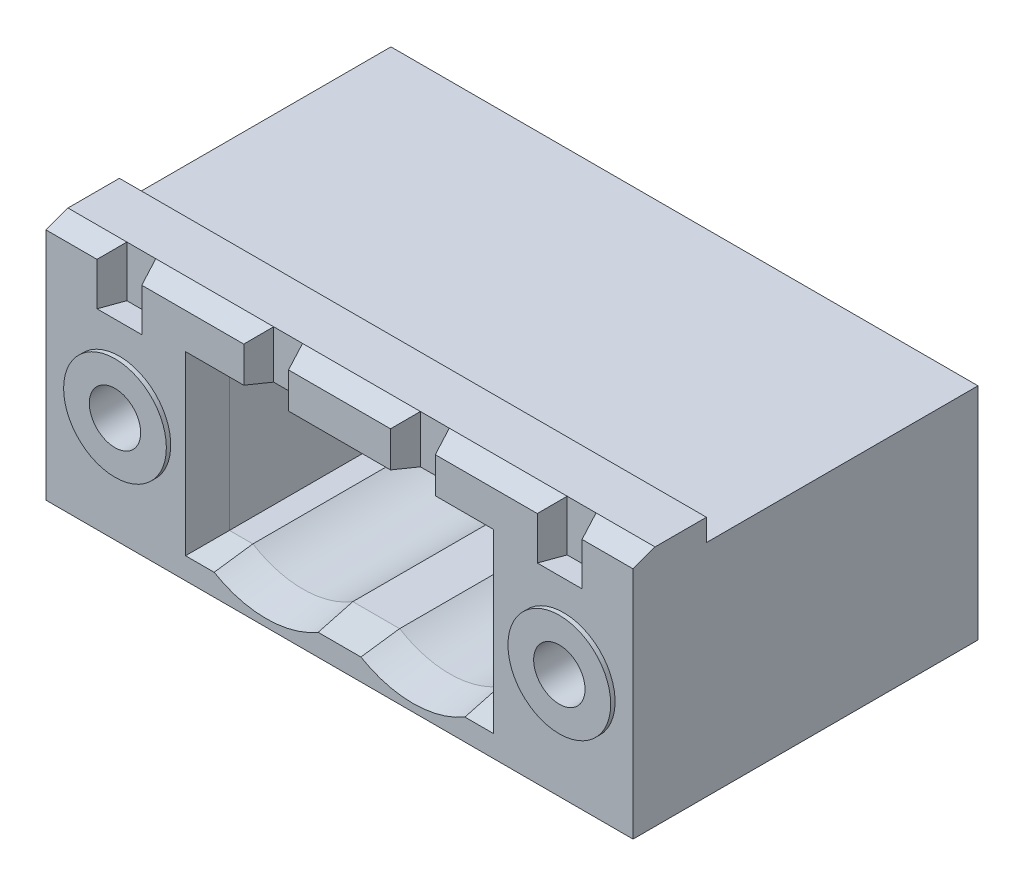
from build123d import *

# Parameters (mm, degrees)
BOSS_EXTRUDE1_DEPTH = 10.16
CUT_EXTRUDE1_DEPTH  = 10
CHAMFER1_SIZE       = 0.25
CHAMFER1_SIZE2      = 1.27
SKETCH3_R           = 1.778
BOSS_EXTRUDE2_DEPTH = 0.152
SKETCH4_R           = 0.889
CUT_EXTRUDE2_DEPTH  = 5.08
BOSS_EXTRUDE3_START = 0.9525
BOSS_EXTRUDE3_DEPTH = 0.9525
BOSS_EXTRUDE4_START = 0.318
BOSS_EXTRUDE4_DEPTH = 0.318
BOSS_EXTRUDE5_START = 0.635
SKETCH9_R           = 1.143
BOSS_EXTRUDE5_DEPTH = 0.635
CUT_EXTRUDE3_REACH  = 18.592
SKETCH11_R          = 0.64
CUT_EXTRUDE4_DEPTH  = 6.7
SKETCH12_R          = 0.64
CUT_EXTRUDE6_DEPTH  = 4
CUT_EXTRUDE7_DEPTH  = 1.27
SKETCH15_R          = 0.125
CUT_EXTRUDE8_DEPTH  = 14.860565005


with BuildPart() as part:
    # Sketch1 → Boss-Extrude1 (new, symmetric)
    with BuildSketch(Plane(origin=(0, 0, 0), x_dir=(0, 0, -1), z_dir=(1, 0, 0))):
        Polygon((-9.94, -3.81), (2, -3.81), (2, 3.81), (-7.4, 3.81), (-7.4, 4.57), (-9.18, 4.57), (-9.94, 4.293), align=None)
    extrude(amount=BOSS_EXTRUDE1_DEPTH, both=True)

    # Sketch2 → Cut-Extrude1 (cut)
    with BuildSketch(Plane.XY.offset(9.94)):
        with BuildLine():
            Line((-0.809711007, -2.81), (0.809711007, -2.81))
            ThreePointArc((0.809711007, -2.81), (2.54, -3.3), (4.270288993, -2.81))
            Line((4.270288993, -2.81), (5.08, -2.81))
            Line((5.08, -2.81), (5.08, 2.81))
            Line((5.08, 2.81), (-5.08, 2.81))
            Line((-5.08, 2.81), (-5.08, -2.81))
            Line((-5.08, -2.81), (-4.270288993, -2.81))
            ThreePointArc((-4.270288993, -2.81), (-2.54, -3.3), (-0.809711007, -2.81))
        make_face()
    extrude(amount=-CUT_EXTRUDE1_DEPTH, mode=Mode.SUBTRACT)

    # Chamfer1
    chamfer1_edges = [part.edges().sort_by_distance(p)[0] for p in [
        (-5.08, 0, 9.94),
        (-4.675144497, -2.81, 9.94),
        (-2.54, -3.3, 9.94),
        (0, -2.81, 9.94),
        (2.54, -3.3, 9.94),
        (4.675144497, -2.81, 9.94),
        (5.08, 0, 9.94),
        (0, 2.81, 9.94),
    ]]
    chamfer1_side = [part.faces().sort_by_distance(p)[0] for p in [
        (-9.941239627, 0.2415, 9.94),
    ]]
    chamfer(chamfer1_edges, length=CHAMFER1_SIZE, length2=CHAMFER1_SIZE2, reference=chamfer1_side[0])

    # Sketch3 → Boss-Extrude2 (add)
    with BuildSketch(Plane.XY.offset(9.94)):
        with Locations(Location((-7.62, 0, 0), (0, 0, 180))):
            Circle(SKETCH3_R)
        with Locations(Location((7.76, 0, 0), (0, 0, 180))):
            Circle(SKETCH3_R)
    extrude(amount=BOSS_EXTRUDE2_DEPTH)

    # Sketch4 → Cut-Extrude2 (cut)
    with BuildSketch(Plane.XY.offset(10.092)):
        with Locations((-7.62, 0)):
            Circle(SKETCH4_R)
        with Locations((7.76, 0)):
            Circle(SKETCH4_R)
    extrude(amount=-CUT_EXTRUDE2_DEPTH, mode=Mode.SUBTRACT)

    # Sketch5 → Boss-Extrude3 (add)
    with BuildSketch(Plane.XY.offset(-0.06).offset(BOSS_EXTRUDE3_START)):
        with BuildLine():
            Line((-3.175, 2.81), (-3.175, 1.662881535))
            ThreePointArc((-3.175, 1.662881535), (-3.798650071, 1.258650071), (-4.202881535, 0.635))
            Line((-4.202881535, 0.635), (-5.08, 0.635))
            Line((-5.08, 0.635), (-5.08, -0.635))
            Line((-5.08, -0.635), (-4.202881535, -0.635))
            ThreePointArc((-4.202881535, -0.635), (-3.798650071, -1.258650071), (-3.175, -1.662881535))
            Line((-3.175, -1.662881535), (-3.175, -3.238329044))
            ThreePointArc((-3.175, -3.238329044), (-2.54, -3.3), (-1.905, -3.238329044))
            Line((-1.905, -3.238329044), (-1.905, -1.662881535))
            ThreePointArc((-1.905, -1.662881535), (-1.281349929, -1.258650071), (-0.877118465, -0.635))
            Line((-0.877118465, -0.635), (0, -0.635))
            Line((0, -0.635), (0, 0.635))
            Line((0, 0.635), (-0.877118465, 0.635))
            ThreePointArc((-0.877118465, 0.635), (-1.281349929, 1.258650071), (-1.905, 1.662881535))
            Line((-1.905, 1.662881535), (-1.905, 2.81))
            Line((-1.905, 2.81), (-3.175, 2.81))
        make_face()
    boss_extrude3 = extrude(amount=-BOSS_EXTRUDE3_DEPTH)

    # Mirror1: Boss-Extrude3 across plane
    add(boss_extrude3.mirror(Plane(origin=(0, 0, 0), x_dir=(0, 0, 1), z_dir=(1, 0, 0))))

    # Sketch8 → Boss-Extrude4 (add)
    with BuildSketch(Plane.XY.offset(0.8925).offset(BOSS_EXTRUDE4_START)):
        with BuildLine():
            Line((-4.202881535, 0.635), (-3.490380976, 0.635))
            ThreePointArc((-3.490380976, 0.635), (-2.54, 1.143), (-1.589619024, 0.635))
            Line((-1.589619024, 0.635), (-0.877118465, 0.635))
            Line((-0.877118465, 0.635), (0.877118465, 0.635))
            Line((0.877118465, 0.635), (1.589619024, 0.635))
            ThreePointArc((1.589619024, 0.635), (2.54, 1.143), (3.490380976, 0.635))
            Line((3.490380976, 0.635), (4.202881535, 0.635))
            Line((4.202881535, 0.635), (5.08, 0.635))
            Line((5.08, 0.635), (5.08, -0.635))
            Line((5.08, -0.635), (4.202881535, -0.635))
            ThreePointArc((4.202881535, -0.635), (3.798650071, -1.258650071), (3.175, -1.662881535))
            Line((3.175, -1.662881535), (3.175, -3.238329044))
            ThreePointArc((3.175, -3.238329044), (2.54, -3.3), (1.905, -3.238329044))
            Line((1.905, -3.238329044), (1.905, -1.662881535))
            ThreePointArc((1.905, -1.662881535), (1.281349929, -1.258650071), (0.877118465, -0.635))
            Line((0.877118465, -0.635), (-0.877118465, -0.635))
            ThreePointArc((-0.877118465, -0.635), (-1.281349929, -1.258650071), (-1.905, -1.662881535))
            Line((-1.905, -1.662881535), (-1.905, -3.238329044))
            ThreePointArc((-1.905, -3.238329044), (-2.54, -3.3), (-3.175, -3.238329044))
            Line((-3.175, -3.238329044), (-3.175, -1.662881535))
            ThreePointArc((-3.175, -1.662881535), (-3.798650071, -1.258650071), (-4.202881535, -0.635))
            Line((-4.202881535, -0.635), (-5.08, -0.635))
            Line((-5.08, -0.635), (-5.08, 0.635))
            Line((-5.08, 0.635), (-4.202881535, 0.635))
        make_face()
    extrude(amount=-BOSS_EXTRUDE4_DEPTH)

    # Sketch9 → Boss-Extrude5 (add)
    with BuildSketch(Plane.XY.offset(1.2105).offset(BOSS_EXTRUDE5_START)):
        with Locations(Location((-2.54, 0, 0), (0, 0, 146.251011404))):
            Circle(SKETCH9_R)
        with Locations(Location((2.54, 0, 0), (0, 0, 146.251011404))):
            Circle(SKETCH9_R)
    extrude(amount=-BOSS_EXTRUDE5_DEPTH)

    # Cut-Extrude3: up to this face of the body (flat: up to its plane)
    cut_extrude3_end = Plane(part.part.faces().sort_by_distance((0, 2.81, 4.414046423))[0])
    # Sketch10 → Cut-Extrude3 (cut, up to the picked face)
    with BuildSketch(Plane(origin=(0, 4.57, 0), x_dir=(1, 0, 0), z_dir=(0, 1, 0)), mode=Mode.PRIVATE) as cut_extrude3_sk1:
        Polygon((-2.04, -9.18), (-1.765, -9.94), (-3.315, -9.94), (-3.04, -9.18), align=None)
    cut_extrude3_tool1 = split(extrude(cut_extrude3_sk1.sketch, amount=-CUT_EXTRUDE3_REACH, mode=Mode.PRIVATE), bisect_by=cut_extrude3_end, keep=Keep.BOTH, mode=Mode.PRIVATE)
    # Sketch10 → Cut-Extrude3 (cut, up to the picked face)
    with BuildSketch(Plane(origin=(0, 4.57, 0), x_dir=(1, 0, 0), z_dir=(0, 1, 0)), mode=Mode.PRIVATE) as cut_extrude3_sk2:
        Polygon((-8.395, -9.94), (-8.12, -9.18), (-7.12, -9.18), (-6.845, -9.94), align=None)
    cut_extrude3_tool2 = split(extrude(cut_extrude3_sk2.sketch, amount=-CUT_EXTRUDE3_REACH, mode=Mode.PRIVATE), bisect_by=cut_extrude3_end, keep=Keep.BOTH, mode=Mode.PRIVATE)
    # Sketch10 → Cut-Extrude3 (cut, up to the picked face)
    with BuildSketch(Plane(origin=(0, 4.57, 0), x_dir=(1, 0, 0), z_dir=(0, 1, 0)), mode=Mode.PRIVATE) as cut_extrude3_sk3:
        Polygon((3.04, -9.18), (3.315, -9.94), (1.765, -9.94), (2.04, -9.18), align=None)
    cut_extrude3_tool3 = split(extrude(cut_extrude3_sk3.sketch, amount=-CUT_EXTRUDE3_REACH, mode=Mode.PRIVATE), bisect_by=cut_extrude3_end, keep=Keep.BOTH, mode=Mode.PRIVATE)
    # Sketch10 → Cut-Extrude3 (cut, up to the picked face)
    with BuildSketch(Plane(origin=(0, 4.57, 0), x_dir=(1, 0, 0), z_dir=(0, 1, 0)), mode=Mode.PRIVATE) as cut_extrude3_sk4:
        Polygon((8.12, -9.18), (8.395, -9.94), (6.845, -9.94), (7.12, -9.18), align=None)
    cut_extrude3_tool4 = split(extrude(cut_extrude3_sk4.sketch, amount=-CUT_EXTRUDE3_REACH, mode=Mode.PRIVATE), bisect_by=cut_extrude3_end, keep=Keep.BOTH, mode=Mode.PRIVATE)
    add(cut_extrude3_tool1.solids().sort_by(Axis((-2.54, 4.57, 9.58732), (0, -1, 0)))[0], mode=Mode.SUBTRACT)
    add(cut_extrude3_tool2.solids().sort_by(Axis((-7.62, 4.57, 9.58732), (0, -1, 0)))[0], mode=Mode.SUBTRACT)
    add(cut_extrude3_tool3.solids().sort_by(Axis((2.54, 4.57, 9.58732), (0, -1, 0)))[0], mode=Mode.SUBTRACT)
    add(cut_extrude3_tool4.solids().sort_by(Axis((7.62, 4.57, 9.58732), (0, -1, 0)))[0], mode=Mode.SUBTRACT)

    # Sketch11 → Cut-Extrude4 (cut)
    with BuildSketch(Plane.XZ.offset(3.81)):
        with Locations(Location((-7.62, 2, 0), (0, 0, 270))):
            Circle(SKETCH11_R)
        with Locations(Location((7.62, 2, 0), (0, 0, 270))):
            Circle(SKETCH11_R)
    extrude(amount=-CUT_EXTRUDE4_DEPTH, mode=Mode.SUBTRACT)

    # Sketch12 → Cut-Extrude6 (cut)
    with BuildSketch(Plane(origin=(0, 0, -2), x_dir=(-1, 0, 0), z_dir=(0, 0, -1))):
        with Locations((-7.76, 0)):
            Circle(SKETCH12_R)
        with Locations((7.62, 0)):
            Circle(SKETCH12_R)
    extrude(amount=-CUT_EXTRUDE6_DEPTH, mode=Mode.SUBTRACT)

    # Sketch13 → Cut-Extrude7 (cut, symmetric)
    with BuildSketch(Plane(origin=(2.54, 0, 0), x_dir=(0, 0, -1), z_dir=(1, 0, 0))):
        Polygon((2, -3.81), (2, 2.79), (1.49, 2.79), (1.49, 1.02), (0.73, 1.02), (0.73, -3.56), (-0.92, -3.56), (-1.17, -3.81), align=None)
    cut_extrude7 = extrude(amount=CUT_EXTRUDE7_DEPTH, both=True, mode=Mode.SUBTRACT)

    # Mirror2: Cut-Extrude7 across plane
    add(cut_extrude7.mirror(Plane(origin=(0, 0, 0), x_dir=(0, 0, 1), z_dir=(1, 0, 0))), mode=Mode.SUBTRACT)

    # Sketch15 → Cut-Extrude8 (cut, through all)
    with BuildSketch(Plane.XY.offset(1.8455)):
        with Locations((-2.54, 0)):
            Circle(SKETCH15_R)
        with Locations((2.54, 0)):
            Circle(SKETCH15_R)
    extrude(amount=-CUT_EXTRUDE8_DEPTH, mode=Mode.SUBTRACT)


solid = part.part
